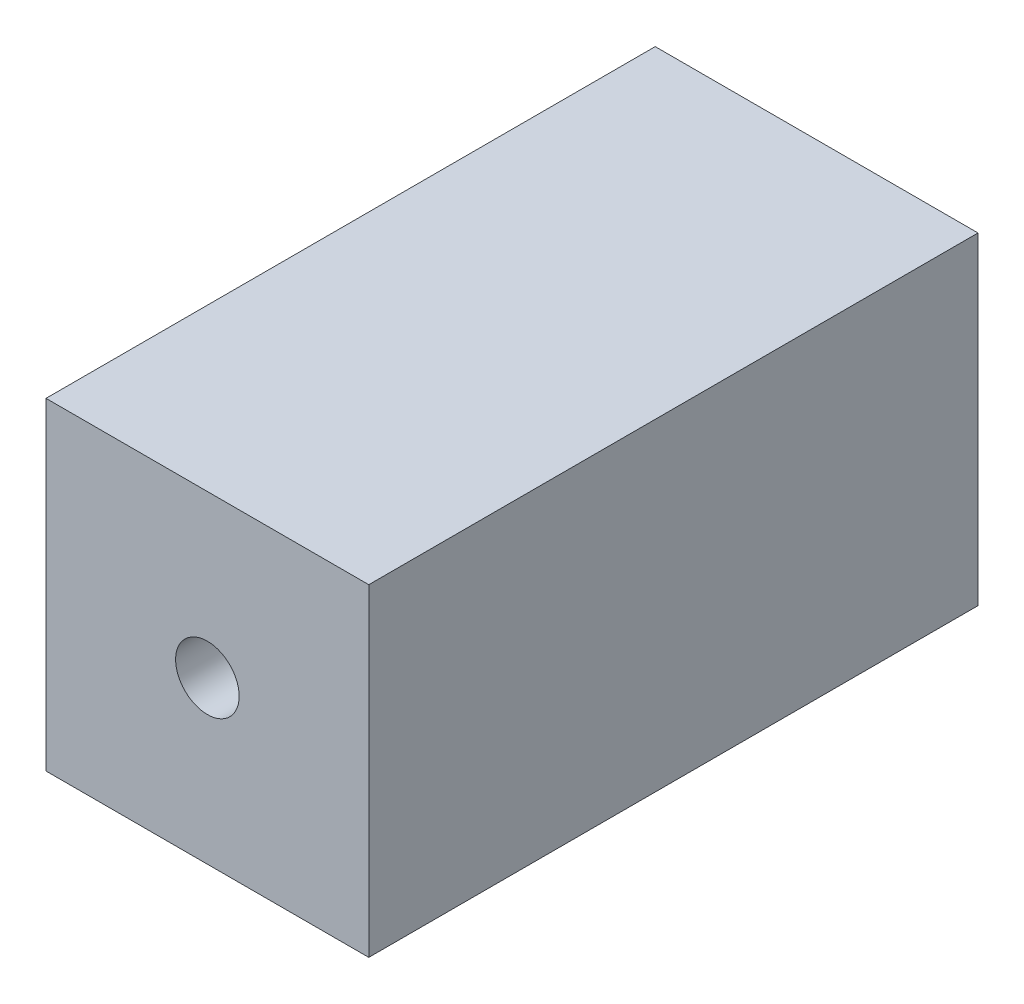
from build123d import *

# Parameters (mm, degrees)
SKETCH1_W           = 25.4
SKETCH1_H           = 25.4
BOSS_EXTRUDE1_DEPTH = 23.970292928
SKETCH2_R           = 2.5
CUT_EXTRUDE1_DEPTH  = 52.194528733


with BuildPart() as part:
    # Sketch1 → Boss-Extrude1 (new, symmetric)
    with BuildSketch(Plane.XY):
        Rectangle(SKETCH1_W, SKETCH1_H)
    extrude(amount=BOSS_EXTRUDE1_DEPTH, both=True)

    # Sketch2 → Cut-Extrude1 (cut, through all)
    with BuildSketch(Plane.XY.offset(23.970292928)):
        Circle(SKETCH2_R)
    extrude(amount=-CUT_EXTRUDE1_DEPTH, mode=Mode.SUBTRACT)


solid = part.part
